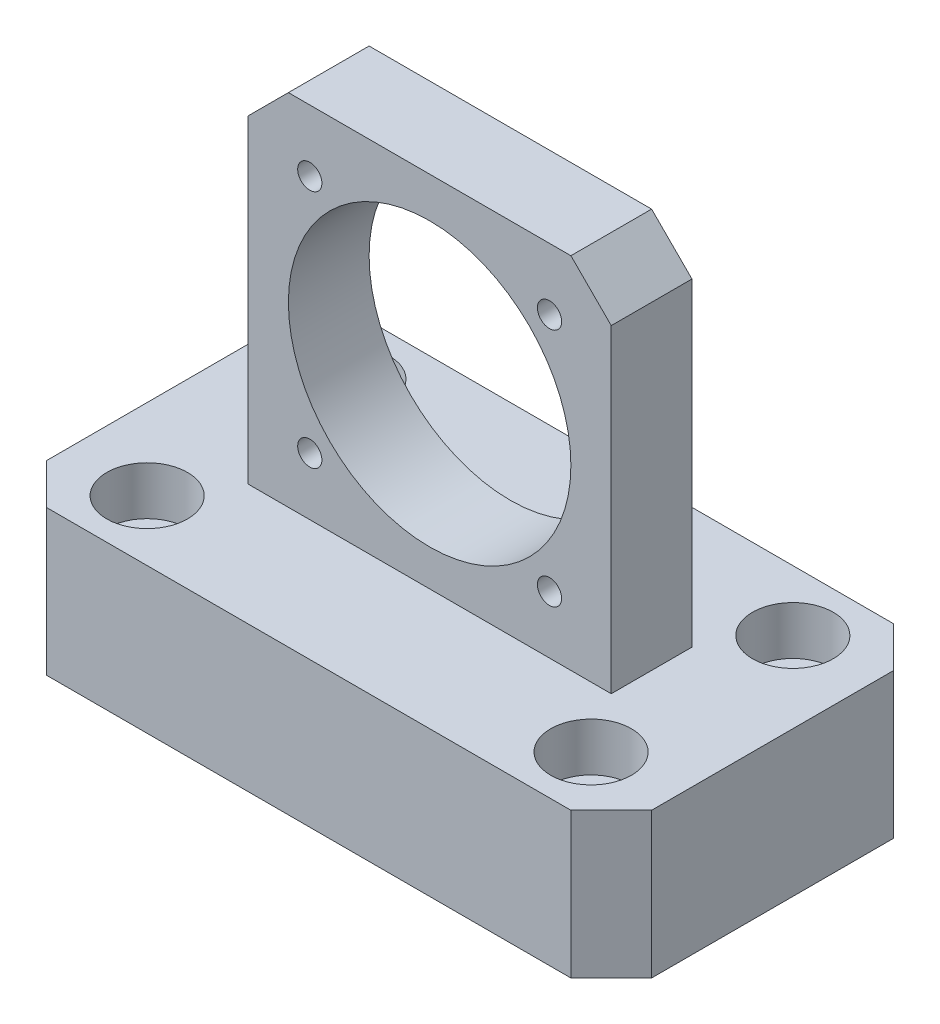
from build123d import *

# Parameters (mm, degrees)
SKETCH_1_W          = 75
SKETCH_1_H          = 40
EXTRUDE_1_DEPTH     = 18
CHAMFER_1_SIZE      = 5
SKETCH_2_W          = 45
SKETCH_2_H          = 10
EXTRUDE_2_DEPTH     = 44.5
CHAMFER_2_SIZE      = 5
SKETCH_3_R          = 17.5
CUT_EXTRUDE_1_DEPTH = 101.778221854
SKETCH_4_R          = 1.5
CUT_EXTRUDE_2_DEPTH = 101.778221854
SKETCH_5_R          = 5
CUT_EXTRUDE_3_DEPTH = 6
SKETCH_6_R          = 2.75
CUT_EXTRUDE_4_DEPTH = 99.869863963


with BuildPart() as part:
    # 스케치1 → 보스-돌출1 (new body)
    with BuildSketch(Plane(origin=(0, 0, 0), x_dir=(1, 0, 0), z_dir=(0, 1, 0))):
        with Locations((37.5, 20)):
            Rectangle(SKETCH_1_W, SKETCH_1_H)
    extrude(amount=EXTRUDE_1_DEPTH)

    # 모따기1
    chamfer_1_edges = [part.edges().sort_by_distance(p)[0] for p in [
        (0, 9, -40),
        (75, 9, -40),
        (75, 9, 0),
        (0, 9, 0),
    ]]
    chamfer(chamfer_1_edges, length=CHAMFER_1_SIZE)

    # 스케치2 → 보스-돌출2 (add)
    with BuildSketch(Plane(origin=(0, 18, 0), x_dir=(1, 0, 0), z_dir=(0, 1, 0))):
        with Locations((37.5, 20)):
            Rectangle(SKETCH_2_W, SKETCH_2_H)
    extrude(amount=EXTRUDE_2_DEPTH)

    # 모따기2
    chamfer_2_edges = [part.edges().sort_by_distance(p)[0] for p in [
        (15, 62.5, -20),
        (60, 62.5, -20),
    ]]
    chamfer(chamfer_2_edges, length=CHAMFER_2_SIZE)

    # 스케치3 → 컷-돌출1 (cut, through all)
    with BuildSketch(Plane.XY.offset(-15)):
        with Locations((37.5, 40)):
            Circle(SKETCH_3_R)
    extrude(amount=-CUT_EXTRUDE_1_DEPTH, mode=Mode.SUBTRACT)

    # 스케치4 → 컷-돌출2 (cut, through all)
    with BuildSketch(Plane.XY.offset(-15)):
        with Locations((22.65, 54.85)):
            Circle(SKETCH_4_R)
        with Locations((52.35, 54.85)):
            Circle(SKETCH_4_R)
        with Locations((52.35, 25.15)):
            Circle(SKETCH_4_R)
        with Locations((22.65, 25.15)):
            Circle(SKETCH_4_R)
    extrude(amount=-CUT_EXTRUDE_2_DEPTH, mode=Mode.SUBTRACT)

    # 스케치5 → 컷-돌출3 (cut)
    with BuildSketch(Plane(origin=(0, 18, 0), x_dir=(1, 0, 0), z_dir=(0, 1, 0))):
        with Locations(Location((10, 32.5, 0), (0, 0, 270))):
            Circle(SKETCH_5_R)
        with Locations(Location((10, 7.5, 0), (0, 0, 270))):
            Circle(SKETCH_5_R)
        with Locations(Location((65, 7.5, 0), (0, 0, 270))):
            Circle(SKETCH_5_R)
        with Locations(Location((65, 32.5, 0), (0, 0, 270))):
            Circle(SKETCH_5_R)
    extrude(amount=-CUT_EXTRUDE_3_DEPTH, mode=Mode.SUBTRACT)

    # 스케치6 → 컷-돌출4 (cut, through all)
    with BuildSketch(Plane(origin=(0, 12, 0), x_dir=(1, 0, 0), z_dir=(0, 1, 0))):
        with Locations(Location((10, 7.5, 0), (0, 0, 270))):
            Circle(SKETCH_6_R)
        with Locations(Location((10, 32.5, 0), (0, 0, 270))):
            Circle(SKETCH_6_R)
        with Locations(Location((65, 7.5, 0), (0, 0, 270))):
            Circle(SKETCH_6_R)
        with Locations(Location((65, 32.5, 0), (0, 0, 270))):
            Circle(SKETCH_6_R)
    extrude(amount=-CUT_EXTRUDE_4_DEPTH, mode=Mode.SUBTRACT)


solid = part.part
